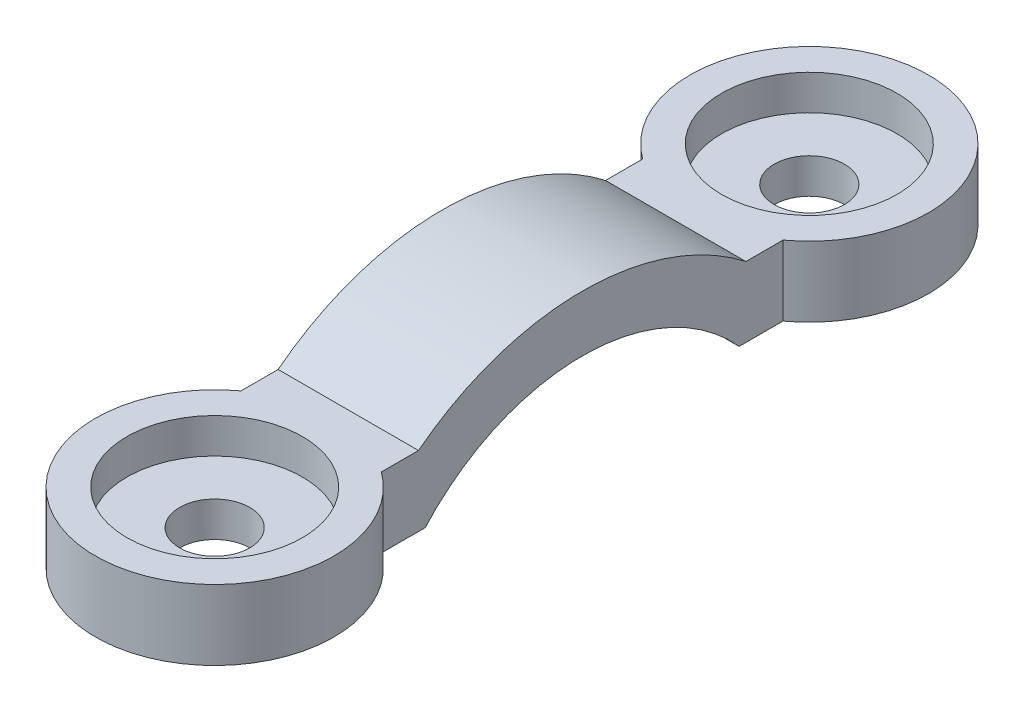
from build123d import *

# Parameters (mm, degrees)
BASE_DEPTH           = 10
ESQUISSE5_R          = 2.5
VIDE_ACCES_VIS_DEPTH = 30.434846638
BOSS_START           = -5
ESQUISSE6_R          = 8.5
ESQUISSE6_R_2        = 2.5
BOSS_VIS_DEPTH       = 5
ESQUISSE7_R          = 6.25
VIDE_ECROU_DEPTH     = 2.5


with BuildPart() as part:
    # Esquisse2 → BASE (new body)
    with BuildSketch(Plane(origin=(0, 0, 0), x_dir=(0, 0, -1), z_dir=(1, 0, 0))):
        with BuildLine():
            Line((-26.180339887, 10), (-16.717843024, 10))
            Line((-16.717843024, 10), (-14.361406616, 10))
            Line((-14.361406616, 10), (-11.180339887, 10))
            ThreePointArc((-11.180339887, 10), (0, 15), (11.180339887, 10))
            Line((11.180339887, 10), (14.361406616, 10))
            Line((14.361406616, 10), (20.155156542, 10))
            Line((20.155156542, 10), (21.180339887, 10))
            Line((21.180339887, 10), (26.180339887, 10))
            Line((26.180339887, 10), (26.180339887, 15))
            Line((26.180339887, 15), (11.66190379, 15))
            ThreePointArc((11.66190379, 15), (0, 19), (-11.66190379, 15))
            Line((-11.66190379, 15), (-26.180339887, 15))
            Line((-26.180339887, 15), (-26.180339887, 10))
        make_face()
    extrude(amount=BASE_DEPTH)

    # Esquisse5 → VIDE ACCES VIS (cut, through all)
    with BuildSketch(Plane.XZ.offset(-10)):
        with Locations(Location((5, 21.180339887, 0), (0, 0, 270))):
            Circle(ESQUISSE5_R)
        with Locations(Location((5, -21.180339887, 0), (0, 0, 270))):
            Circle(ESQUISSE5_R)
    extrude(amount=-VIDE_ACCES_VIS_DEPTH, mode=Mode.SUBTRACT)

    # Esquisse6 → BOSS VIS (add)
    # profile 1 of 2: a face of its own
    with BuildSketch(Plane(origin=(0, 15, 0), x_dir=(1, 0, 0), z_dir=(0, 1, 0)).offset(BOSS_START)):
        with Locations((5, -21.180339887)):
            Circle(ESQUISSE6_R)
        with Locations(Location((5, -21.180339887, 0), (0, 0, 90))):
            Circle(ESQUISSE6_R_2, mode=Mode.SUBTRACT)
    # profile 2 of 2: a face of its own
    with BuildSketch(Plane(origin=(0, 15, 0), x_dir=(1, 0, 0), z_dir=(0, 1, 0)).offset(BOSS_START)):
        with Locations((5, 21.180339887)):
            Circle(ESQUISSE6_R)
        with Locations(Location((5, 21.180339887, 0), (0, 0, 90))):
            Circle(ESQUISSE6_R_2, mode=Mode.SUBTRACT)
    extrude(amount=BOSS_VIS_DEPTH)

    # Esquisse7 → VIDE ECROU (cut)
    with BuildSketch(Plane(origin=(0, 15, 0), x_dir=(1, 0, 0), z_dir=(0, 1, 0))):
        with Locations(Location((5, 21.180339887, 0), (0, 0, 270))):
            Circle(ESQUISSE7_R)
        with Locations(Location((5, -21.180339887, 0), (0, 0, 270))):
            Circle(ESQUISSE7_R)
    extrude(amount=-VIDE_ECROU_DEPTH, mode=Mode.SUBTRACT)


solid = part.part
